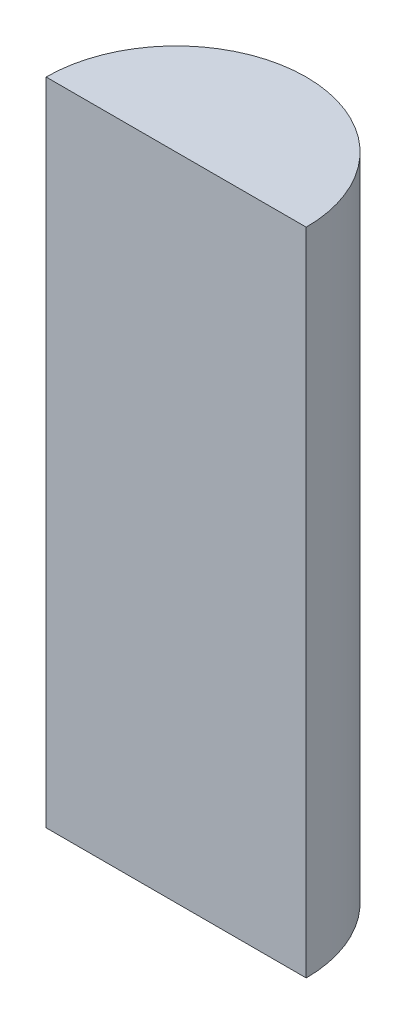
from build123d import *

# Parameters (mm, degrees)
SKETCH_1_W      = 10
SKETCH_1_H      = 50
REVOLVE_4_ANGLE = 180


with BuildPart() as part:
    # 스케치1 → 회전-얇게4 (revolve)
    with BuildSketch(Plane.XY):
        with Locations((5, 0)):
            Rectangle(SKETCH_1_W, SKETCH_1_H)
    revolve(axis=Axis((0, 25, 0), (0, 1, 0)), revolution_arc=REVOLVE_4_ANGLE)


solid = part.part
